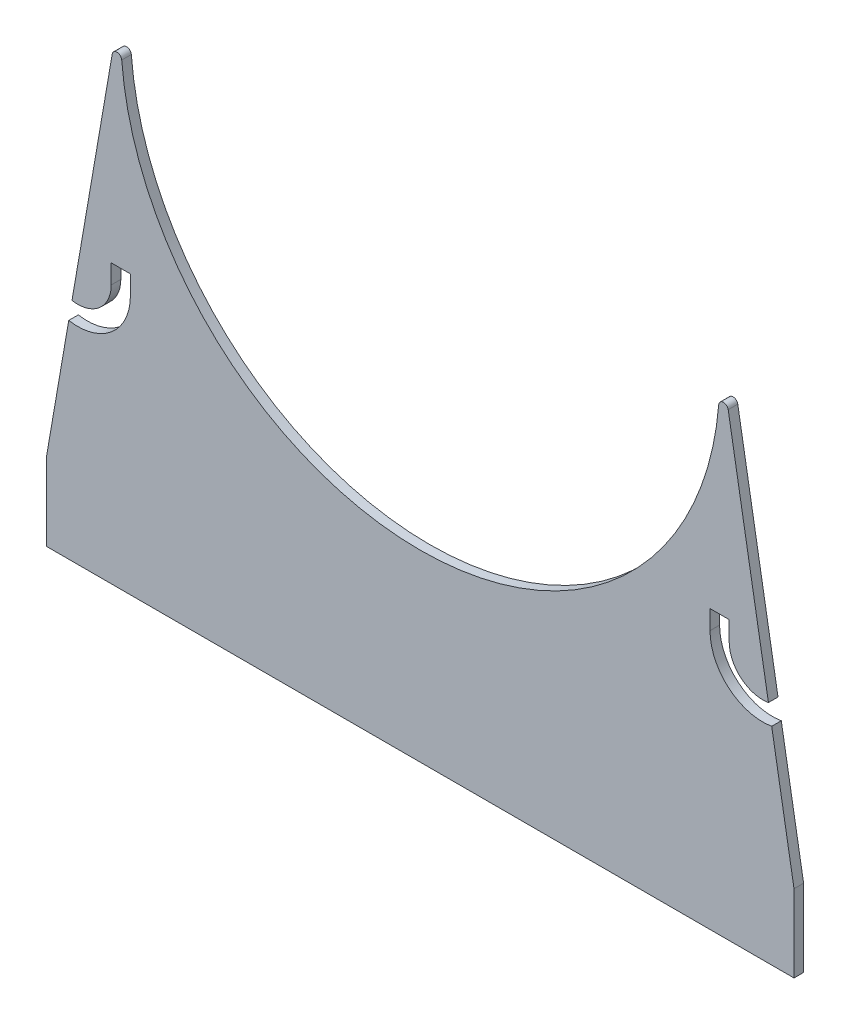
from build123d import *

# Parameters (mm, degrees)
EXTRUDE_1_DEPTH     = 1
EXTRUDE_2_DEPTH     = 0.2
EXTRUDE_START       = -1
EXTRUDE_3_DEPTH     = 1
CUT_EXTRUDE_1_REACH = 99.25
FILLET_1_R          = 0.5


with BuildPart() as part:
    # 草图1 → 凸台-拉伸1 (new body)
    with BuildSketch(Plane.XY):
        with BuildLine():
            Line((77.564020285, 17.400000002), (57.663521733, 17.400000002))
            ThreePointArc((57.663521733, 17.400000002), (40, 13.400000002), (22.336478267, 17.400000002))
            Line((22.336478267, 17.400000002), (2.435979715, 17.400000002))
            Line((2.435979715, 17.400000002), (1, 9.067418693))
            Line((1, 9.067418693), (1, 1))
            Line((1, 1), (79, 1))
            Line((79, 1), (79, 9.067418693))
            Line((79, 9.067418693), (77.564020285, 17.400000002))
        make_face()
    extrude(amount=EXTRUDE_1_DEPTH)

    # 草图2 → 凸台-拉伸2 (add)
    # profile 1 of 5: a face of its own
    with BuildSketch(Plane(origin=(0, 0, 0), x_dir=(-1, 0, 0), z_dir=(0, 0, -1))):
        with BuildLine():
            Line((-47.688311688, 9.067418693), (-47.688311688, 13.067418693))
            Line((-47.688311688, 13.067418693), (-46.456168831, 13.067418693))
            add(Edge.make_bspline(
                [(-46.456168831, 13.067418693), (-46.420988221, 13.067451705), (-46.353305987, 13.067515216), (-46.255375892, 13.062724044), (-46.164329229, 13.057882688), (-46.080485367, 13.048540998), (-46.003780872, 13.038340211), (-45.934294083, 13.025593097), (-45.872011125, 13.009482907), (-45.833269101, 12.996467591), (-45.814935065, 12.990308303)],
                knots=[0, 0, 0, 0, 1.301145482, 2.503209419, 3.626350361, 4.67304202, 5.622796861, 6.488461115, 7.284688674, 8, 8, 8, 8], degree=3))
            add(Edge.make_bspline(
                [(-45.814935065, 12.990308303), (-45.791719499, 12.981322614), (-45.74534338, 12.963372528), (-45.68001996, 12.927935397), (-45.617705889, 12.888011907), (-45.559107384, 12.842561949), (-45.504568127, 12.790885007), (-45.453234408, 12.734116528), (-45.406126096, 12.671089494), (-45.362722293, 12.603146313), (-45.32230664, 12.530972452), (-45.288936916, 12.453685342), (-45.258960982, 12.372914459), (-45.236153868, 12.287713781), (-45.216879687, 12.198685981), (-45.204603556, 12.105561237), (-45.195853867, 12.008332403), (-45.195160066, 11.942169373), (-45.194805195, 11.908327784)],
                knots=[0, 0, 0, 0, 0.897158766, 1.79219156, 2.674738776, 3.564969572, 4.462552928, 5.381685756, 6.322532571, 7.297145314, 8.28871417, 9.302465757, 10.330585605, 11.393732126, 12.480975679, 13.614163778, 14.779673607, 16, 16, 16, 16], degree=3))
            add(Edge.make_bspline(
                [(-45.194805195, 11.908327784), (-45.195492301, 11.86392354), (-45.196836119, 11.777079255), (-45.210030339, 11.650058884), (-45.23195871, 11.529625528), (-45.261877634, 11.415200622), (-45.300734436, 11.306956964), (-45.348850036, 11.205179001), (-45.405295291, 11.109502236), (-45.469735671, 11.019748146), (-45.545672476, 10.938050274), (-45.635292745, 10.868158341), (-45.736690133, 10.808382382), (-45.851130434, 10.760869847), (-45.977446286, 10.722492562), (-46.116782858, 10.696330241), (-46.268601777, 10.68117741), (-46.373881482, 10.678960123), (-46.428571429, 10.677808303)],
                knots=[0, 0, 0, 0, 1.066125632, 2.085091685, 3.062630143, 4.003547869, 4.922307223, 5.820454748, 6.703048758, 7.586837887, 8.469431897, 9.371589709, 10.306565591, 11.287746888, 12.340181319, 13.471797101, 14.68666727, 16, 16, 16, 16], degree=3))
            Line((-46.428571429, 10.677808303), (-47.272727273, 10.677808303))
            Line((-47.272727273, 10.677808303), (-47.272727273, 9.067418693))
            Line((-47.272727273, 9.067418693), (-47.688311688, 9.067418693))
        make_face()
        with BuildLine():
            Line((-47.272727273, 11.145340771), (-46.402597403, 11.145340771))
            add(Edge.make_bspline(
                [(-46.402597403, 11.145340771), (-46.369576425, 11.146082646), (-46.305597929, 11.147520039), (-46.21273581, 11.155186787), (-46.1267185, 11.169809004), (-46.047573856, 11.189833221), (-45.975522203, 11.215944864), (-45.910204103, 11.247343108), (-45.851992493, 11.285134467), (-45.799970366, 11.328329831), (-45.755631701, 11.378518048), (-45.715747093, 11.433187935), (-45.68340165, 11.494920917), (-45.656968623, 11.562252145), (-45.635497696, 11.634962097), (-45.621331024, 11.713615201), (-45.612275826, 11.797997292), (-45.611030842, 11.856354969), (-45.61038961, 11.886412199)],
                knots=[0, 0, 0, 0, 1.269306236, 2.459294321, 3.577321076, 4.618943517, 5.592639886, 6.518111891, 7.397820391, 8.253919533, 9.107995395, 9.965041305, 10.848919063, 11.777714976, 12.741869721, 13.757527659, 14.845010431, 16, 16, 16, 16], degree=3))
            add(Edge.make_bspline(
                [(-45.61038961, 11.886412199), (-45.611312785, 11.92545432), (-45.613099182, 12.001003068), (-45.63157716, 12.109672401), (-45.66016068, 12.209917325), (-45.701994512, 12.299721411), (-45.750918691, 12.378470811), (-45.80449034, 12.445835227), (-45.864323149, 12.498759859), (-45.920007717, 12.531746424), (-45.968910958, 12.552550358), (-46.012490408, 12.565388633), (-46.062812167, 12.575472764), (-46.119694611, 12.58430334), (-46.183026934, 12.591749249), (-46.252929988, 12.596136189), (-46.329508417, 12.599736152), (-46.382841096, 12.599834714), (-46.410714286, 12.599886225)],
                knots=[0, 0, 0, 0, 1.500314686, 2.903195123, 4.226916567, 5.498136997, 6.699407891, 7.786731959, 8.797026544, 9.75363827, 10.261964553, 10.838097333, 11.497334866, 12.234733717, 13.051831226, 13.948971176, 14.928073425, 16, 16, 16, 16], degree=3))
            Line((-46.410714286, 12.599886225), (-47.272727273, 12.599886225))
            Line((-47.272727273, 12.599886225), (-47.272727273, 11.145340771))
        make_face(mode=Mode.SUBTRACT)
    # profile 2 of 5: a face of its own
    with BuildSketch(Plane(origin=(0, 0, 0), x_dir=(-1, 0, 0), z_dir=(0, 0, -1))):
        Polygon((-44.987012987, 9.067418693), (-43.711038961, 13.067418693), (-43.305194805, 13.067418693), (-42.025974026, 9.067418693), (-42.456980519, 9.067418693), (-42.80762987, 10.262223888), (-44.204545455, 10.262223888), (-44.553571429, 9.067418693), align=None)
        with BuildLine():
            Line((-44.068181818, 10.729756355), (-42.944805195, 10.729756355))
            Line((-42.944805195, 10.729756355), (-43.279220779, 11.828782329))
            add(Edge.make_bspline(
                [(-43.279220779, 11.828782329), (-43.29173135, 11.869888674), (-43.316156416, 11.95014282), (-43.350744536, 12.067659589), (-43.383941273, 12.179122049), (-43.412297682, 12.285307708), (-43.440494748, 12.384834988), (-43.464812799, 12.478811463), (-43.486642302, 12.566770737), (-43.500051875, 12.623683221), (-43.506493506, 12.651022589)],
                knots=[0, 0, 0, 0, 1.20859176, 2.359599242, 3.445754582, 4.479676267, 5.450859039, 6.355343929, 7.209947359, 8, 8, 8, 8], degree=3))
            add(Edge.make_bspline(
                [(-43.506493506, 12.651022589), (-43.518301709, 12.587368598), (-43.541891579, 12.460203651), (-43.583993104, 12.270187907), (-43.63460335, 12.081486108), (-43.67254892, 11.956387708), (-43.691558442, 11.893717394)],
                knots=[0, 0, 0, 0, 0.99576119, 1.989284839, 2.992695748, 4, 4, 4, 4], degree=3))
            Line((-43.691558442, 11.893717394), (-44.068181818, 10.729756355))
        make_face(mode=Mode.SUBTRACT)
    # profile 3 of 5: a face of its own
    with BuildSketch(Plane(origin=(0, 0, 0), x_dir=(-1, 0, 0), z_dir=(0, 0, -1))):
        with BuildLine():
            Line((-41.558441558, 9.067418693), (-41.558441558, 13.067418693))
            Line((-41.558441558, 13.067418693), (-40.089285714, 13.067418693))
            add(Edge.make_bspline(
                [(-40.089285714, 13.067418693), (-40.052209917, 13.06720528), (-39.980445893, 13.066792198), (-39.876485311, 13.060849775), (-39.77981822, 13.052053112), (-39.690573408, 13.040356979), (-39.609271859, 13.024141513), (-39.535591159, 13.00447099), (-39.468931882, 12.982514572), (-39.390676412, 12.946297262), (-39.301396836, 12.890120624), (-39.205108878, 12.80453268), (-39.120768476, 12.698543056), (-39.045718028, 12.576765164), (-38.984084279, 12.440037422), (-38.94042634, 12.290927515), (-38.914070901, 12.131394561), (-38.910779778, 12.021526006), (-38.909090909, 11.965145965)],
                knots=[0, 0, 0, 0, 0.957775898, 1.853873864, 2.6892683, 3.465319774, 4.178195347, 4.829309051, 5.435011313, 5.988660553, 7.053440284, 8.147710094, 9.30058322, 10.540256924, 11.835580405, 13.162637032, 14.543981594, 16, 16, 16, 16], degree=3))
            add(Edge.make_bspline(
                [(-38.909090909, 11.965145965), (-38.909973941, 11.927784357), (-38.911698778, 11.854805456), (-38.92214738, 11.747842226), (-38.940304638, 11.646381982), (-38.968073048, 11.55068726), (-39.000277595, 11.459568893), (-39.042566311, 11.374624131), (-39.091084554, 11.294755916), (-39.147476522, 11.220599066), (-39.210553009, 11.152318947), (-39.281343221, 11.090988836), (-39.35847071, 11.03573787), (-39.442536858, 10.987051182), (-39.533021388, 10.944305572), (-39.630994605, 10.910196388), (-39.734929575, 10.880326083), (-39.80722523, 10.866625249), (-39.844155844, 10.859626485)],
                knots=[0, 0, 0, 0, 1.121977975, 2.191573688, 3.224240956, 4.211948119, 5.180998842, 6.122125515, 7.055751929, 7.983633331, 8.914994346, 9.842128418, 10.791356962, 11.759862547, 12.75578979, 13.791489111, 14.871831714, 16, 16, 16, 16], degree=3))
            add(Edge.make_bspline(
                [(-39.844155844, 10.859626485), (-39.816897295, 10.844544991), (-39.765007597, 10.815835678), (-39.693994652, 10.769515952), (-39.633305939, 10.722892864), (-39.598998048, 10.688964662), (-39.582792208, 10.672938173)],
                knots=[0, 0, 0, 0, 1.158843086, 2.205987482, 3.152571606, 4, 4, 4, 4], degree=3))
            add(Edge.make_bspline(
                [(-39.582792208, 10.672938173), (-39.5503783, 10.633813285), (-39.485185993, 10.555123553), (-39.395817713, 10.42958395), (-39.310214673, 10.298987648), (-39.259944538, 10.207119882), (-39.234577922, 10.160762849)],
                knots=[0, 0, 0, 0, 0.982253192, 1.975551771, 2.978451105, 4, 4, 4, 4], degree=3))
            Line((-39.234577922, 10.160762849), (-38.649350649, 9.067418693))
            Line((-38.649350649, 9.067418693), (-39.121753247, 9.067418693))
            Line((-39.121753247, 9.067418693), (-39.583603896, 9.922938173))
            add(Edge.make_bspline(
                [(-39.583603896, 9.922938173), (-39.605118993, 9.963052356), (-39.646272238, 10.03978121), (-39.707347924, 10.14872487), (-39.76412205, 10.24697591), (-39.816498737, 10.334630155), (-39.865254187, 10.410757684), (-39.909043681, 10.476404598), (-39.949146719, 10.530823312), (-39.997143707, 10.586891022), (-40.052932409, 10.645010938), (-40.119251608, 10.703381552), (-40.185493782, 10.748631637), (-40.252937393, 10.78309104), (-40.327178324, 10.805791876), (-40.410833242, 10.822783743), (-40.507644085, 10.832026033), (-40.576280757, 10.833087374), (-40.612824675, 10.833652459)],
                knots=[0, 0, 0, 0, 1.483643366, 2.83785556, 4.070616892, 5.1822306, 6.165666296, 7.016844219, 7.754091418, 8.367230408, 9.421242841, 10.377779407, 11.241203819, 12.029974219, 12.835959019, 13.762973995, 14.808950166, 16, 16, 16, 16], degree=3))
            Line((-40.612824675, 10.833652459), (-41.142857143, 10.833652459))
            Line((-41.142857143, 10.833652459), (-41.142857143, 9.067418693))
            Line((-41.142857143, 9.067418693), (-41.558441558, 9.067418693))
        make_face()
        with BuildLine():
            Line((-41.142857143, 11.301184926), (-40.168019481, 11.301184926))
            add(Edge.make_bspline(
                [(-40.168019481, 11.301184926), (-40.117939328, 11.302160492), (-40.024084235, 11.303988797), (-39.892780987, 11.316131394), (-39.780709904, 11.338104918), (-39.685777605, 11.370108353), (-39.604827592, 11.412513987), (-39.53435, 11.465026721), (-39.472531873, 11.527742047), (-39.419948954, 11.60028379), (-39.376471908, 11.681067768), (-39.347128412, 11.769872592), (-39.327211224, 11.864152396), (-39.325534388, 11.929323136), (-39.324675325, 11.9627109)],
                knots=[0, 0, 0, 0, 1.47306528, 2.760668081, 3.873497699, 4.82484281, 5.696997418, 6.550136397, 7.399890849, 8.276969651, 9.17766846, 10.086208714, 11.019541422, 12, 12, 12, 12], degree=3))
            add(Edge.make_bspline(
                [(-39.324675325, 11.9627109), (-39.32542561, 11.986806732), (-39.32688831, 12.033782189), (-39.334584202, 12.102408844), (-39.349604309, 12.166988394), (-39.369422413, 12.22786787), (-39.396066703, 12.284491073), (-39.427180932, 12.337751806), (-39.466365711, 12.385460317), (-39.509007889, 12.430626029), (-39.558356729, 12.470722871), (-39.613466297, 12.505465882), (-39.674325486, 12.534650642), (-39.740349995, 12.559675366), (-39.81287988, 12.576320945), (-39.890215321, 12.590737791), (-39.973317672, 12.598730658), (-40.030558163, 12.599493163), (-40.060064935, 12.599886225)],
                knots=[0, 0, 0, 0, 1.045235731, 2.037714497, 2.988326782, 3.915852726, 4.808207886, 5.697550021, 6.58254782, 7.478674216, 8.387536059, 9.331464042, 10.296946822, 11.310355404, 12.385965615, 13.518246496, 14.720686494, 16, 16, 16, 16], degree=3))
            Line((-40.060064935, 12.599886225), (-41.142857143, 12.599886225))
            Line((-41.142857143, 12.599886225), (-41.142857143, 11.301184926))
        make_face(mode=Mode.SUBTRACT)
    # profile 4 of 5: a face of its own
    with BuildSketch(Plane(origin=(0, 0, 0), x_dir=(-1, 0, 0), z_dir=(0, 0, -1))):
        Polygon((-37.402597403, 9.067418693), (-37.402597403, 12.599886225), (-38.493506494, 12.599886225), (-38.493506494, 13.067418693), (-35.896103896, 13.067418693), (-35.896103896, 12.599886225), (-36.987012987, 12.599886225), (-36.987012987, 9.067418693), align=None)
    # profile 5 of 5: a face of its own
    with BuildSketch(Plane(origin=(0, 0, 0), x_dir=(-1, 0, 0), z_dir=(0, 0, -1))):
        Polygon((-33.038961039, 9.067418693), (-33.038961039, 10.05443168), (-34.441558442, 10.05443168), (-34.441558442, 10.521964147), (-33.015422078, 13.119366745), (-32.623376623, 13.119366745), (-32.623376623, 10.521964147), (-32.155844156, 10.521964147), (-32.155844156, 10.05443168), (-32.623376623, 10.05443168), (-32.623376623, 9.067418693), align=None)
        Polygon((-33.038961039, 10.521964147), (-33.038961039, 12.329594017), (-34.031655844, 10.521964147), align=None, mode=Mode.SUBTRACT)
    extrude(amount=EXTRUDE_2_DEPTH)

    # 草图3 → 凸台-拉伸3 (add)
    with BuildSketch(Plane.XY.offset(1).offset(EXTRUDE_START)):
        with BuildLine():
            Line((2.435979715, 17.400000002), (9.209736615, 56.706182083))
            ThreePointArc((9.209736615, 56.706182083), (40, 20.155866351), (70.790263385, 56.706182083))
            Line((70.790263385, 56.706182083), (77.564020285, 17.400000002))
            Line((77.564020285, 17.400000002), (57.663521733, 17.400000002))
            ThreePointArc((57.663521733, 17.400000002), (40, 13.400000002), (22.336478267, 17.400000002))
            Line((22.336478267, 17.400000002), (2.435979715, 17.400000002))
        make_face()
    extrude(amount=EXTRUDE_3_DEPTH)

    # 草图4 → 切除-拉伸1 (cut, up to next)
    with BuildSketch(Plane(origin=(0, 0, 0), x_dir=(-1, 0, 0), z_dir=(0, 0, -1)), mode=Mode.PRIVATE) as cut_extrude_1_sk1:
        with BuildLine():
            Line((-9.386186144, 30), (-7.762710761, 30))
            Line((-7.762710761, 30), (-7.762710761, 28))
            ThreePointArc((-7.762710761, 28), (-6.517659329, 25.323209579), (-3.668306785, 24.550843014))
            Line((-3.668306785, 24.550843014), (-3.32864737, 22.579896165))
            ThreePointArc((-3.32864737, 22.579896165), (-7.806201367, 23.793615052), (-9.762710761, 28))
            Line((-9.762710761, 28), (-9.762710761, 30))
            Line((-9.762710761, 30), (-9.386186144, 30))
        make_face()
    cut_extrude_1_tool1 = extrude(cut_extrude_1_sk1.sketch, amount=-CUT_EXTRUDE_1_REACH, mode=Mode.PRIVATE) & part.part
    # 草图4 → 切除-拉伸1 (cut, up to next)
    with BuildSketch(Plane(origin=(0, 0, 0), x_dir=(-1, 0, 0), z_dir=(0, 0, -1)), mode=Mode.PRIVATE) as cut_extrude_1_sk2:
        with BuildLine():
            Line((-70.613813856, 30), (-70.237289239, 30))
            Line((-70.237289239, 30), (-70.237289239, 28))
            ThreePointArc((-70.237289239, 28), (-72.193798633, 23.793615052), (-76.67135263, 22.579896165))
            Line((-76.67135263, 22.579896165), (-76.331693215, 24.550843014))
            ThreePointArc((-76.331693215, 24.550843014), (-73.482340671, 25.323209579), (-72.237289239, 28))
            Line((-72.237289239, 28), (-72.237289239, 30))
            Line((-72.237289239, 30), (-70.613813856, 30))
        make_face()
    cut_extrude_1_tool2 = extrude(cut_extrude_1_sk2.sketch, amount=-CUT_EXTRUDE_1_REACH, mode=Mode.PRIVATE) & part.part
    add(cut_extrude_1_tool1.solids().sort_by_distance((7.239807, 25.75541, 0))[0], mode=Mode.SUBTRACT)
    add(cut_extrude_1_tool2.solids().sort_by_distance((72.760193, 25.75541, 0))[0], mode=Mode.SUBTRACT)

    # 圆角1
    fillet_1_edges = [part.edges().sort_by_distance(p)[0] for p in [
        (9.209736615, 56.706182083, 0.5),
        (70.790263385, 56.706182083, 0.5),
    ]]
    fillet(fillet_1_edges, radius=FILLET_1_R)


solid = part.part
